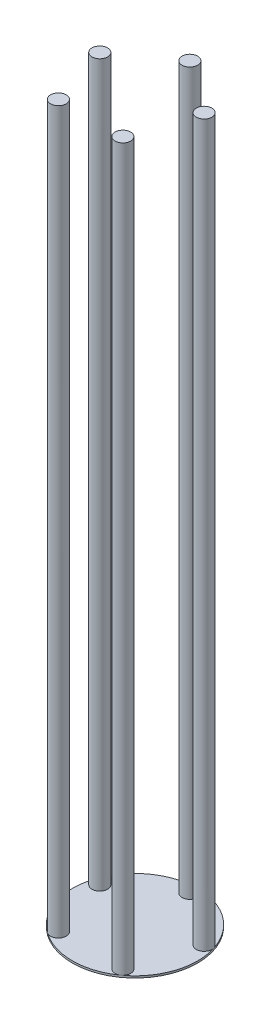
from build123d import *

# Parameters (mm, degrees)
SKETCH5_R            = 101.6
BOSS_EXTRUDE9_DEPTH  = 3.175
SKETCH6_R            = 12.7
BOSS_EXTRUDE10_DEPTH = 1168.4


with BuildPart() as part:
    # Sketch5 → Boss-Extrude9 (new body)
    with BuildSketch(Plane(origin=(0, 0, 0), x_dir=(1, 0, 0), z_dir=(0, 1, 0))):
        with Locations(Location((0, 0, 0), (0, 0, 270))):
            Circle(SKETCH5_R)
    extrude(amount=BOSS_EXTRUDE9_DEPTH)

    # Sketch6 → Boss-Extrude10 (add)
    with BuildSketch(Plane(origin=(0, 3.175, 0), x_dir=(1, 0, 0), z_dir=(0, 1, 0))):
        with Locations(Location((0, 88.9, 0), (0, 0, 89.999756917))):
            Circle(SKETCH6_R)
        with Locations(Location((84.548924299, 27.4716108, 0), (0, 0, 17.999752599))):
            Circle(SKETCH6_R)
        with Locations(Location((52.254108929, -71.9216108, 0), (0, 0, 305.999749955))):
            Circle(SKETCH6_R)
        with Locations(Location((-52.254108929, -71.9216108, 0), (0, 0, 233.999752099))):
            Circle(SKETCH6_R)
        with Locations(Location((-84.548924299, 27.4716108, 0), (0, 0, 161.999755865))):
            Circle(SKETCH6_R)
    extrude(amount=BOSS_EXTRUDE10_DEPTH)


solid = part.part
